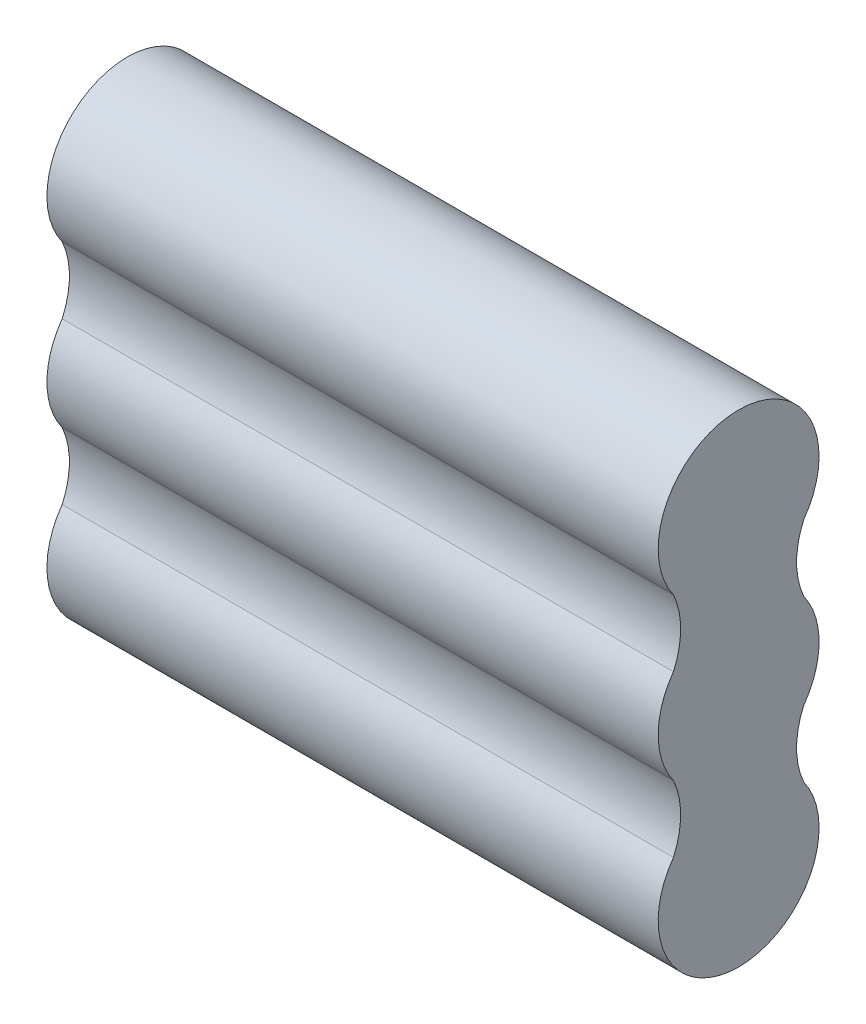
from build123d import *

# Parameters (mm, degrees)
SKETCH1_W              = 67.564
SKETCH1_H              = 55.88
BOSS_EXTRUDE1_DEPTH    = 17.78
SPLIT1_SURFACE_1_BACK  = 90.463
SPLIT1_SURFACE_1_DEPTH = 180.926


with BuildPart() as part:
    # Sketch1 → Boss-Extrude1 (new body)
    with BuildSketch(Plane.XY):
        Rectangle(SKETCH1_W, SKETCH1_H)
    extrude(amount=BOSS_EXTRUDE1_DEPTH)

    # Split1: cut with a surface, the side it looks to stays
    # Split1 surface: a surface, the sketch's curves swept straight by 180.926 mm
    with BuildLine(Plane(origin=(33.782, 0, 0), x_dir=(0, 0, -1), z_dir=(1, 0, 0)).offset(-SPLIT1_SURFACE_1_BACK), mode=Mode.PRIVATE) as split1_surface_1_path:
        ThreePointArc((-1.685204779, 12.572022866), (-8.89, 26.67), (-16.094795221, 12.572022866))
        ThreePointArc((-16.094795221, 12.572022866), (-15.296445708, 8.89), (-16.094795221, 5.207977134))
        ThreePointArc((-16.094795221, 5.207977134), (-17.78, 0), (-16.094795221, -5.207977134))
        ThreePointArc((-16.094795221, -5.207977134), (-15.296445708, -8.89), (-16.094795221, -12.572022866))
        ThreePointArc((-16.094795221, -12.572022866), (-8.89, -26.67), (-1.685204779, -12.572022866))
        ThreePointArc((-1.685204779, -12.572022866), (-2.483554292, -8.89), (-1.685204779, -5.207977134))
        ThreePointArc((-1.685204779, -5.207977134), (0, 0), (-1.685204779, 5.207977134))
        ThreePointArc((-1.685204779, 5.207977134), (-2.483554292, 8.89), (-1.685204779, 12.572022866))
    split1_surface_1 = Shell.extrude(split1_surface_1_path.wire(), (1 * SPLIT1_SURFACE_1_DEPTH, 0 * SPLIT1_SURFACE_1_DEPTH, 0 * SPLIT1_SURFACE_1_DEPTH))
    split(bisect_by=split1_surface_1, keep=Keep.TOP)


solid = part.part
